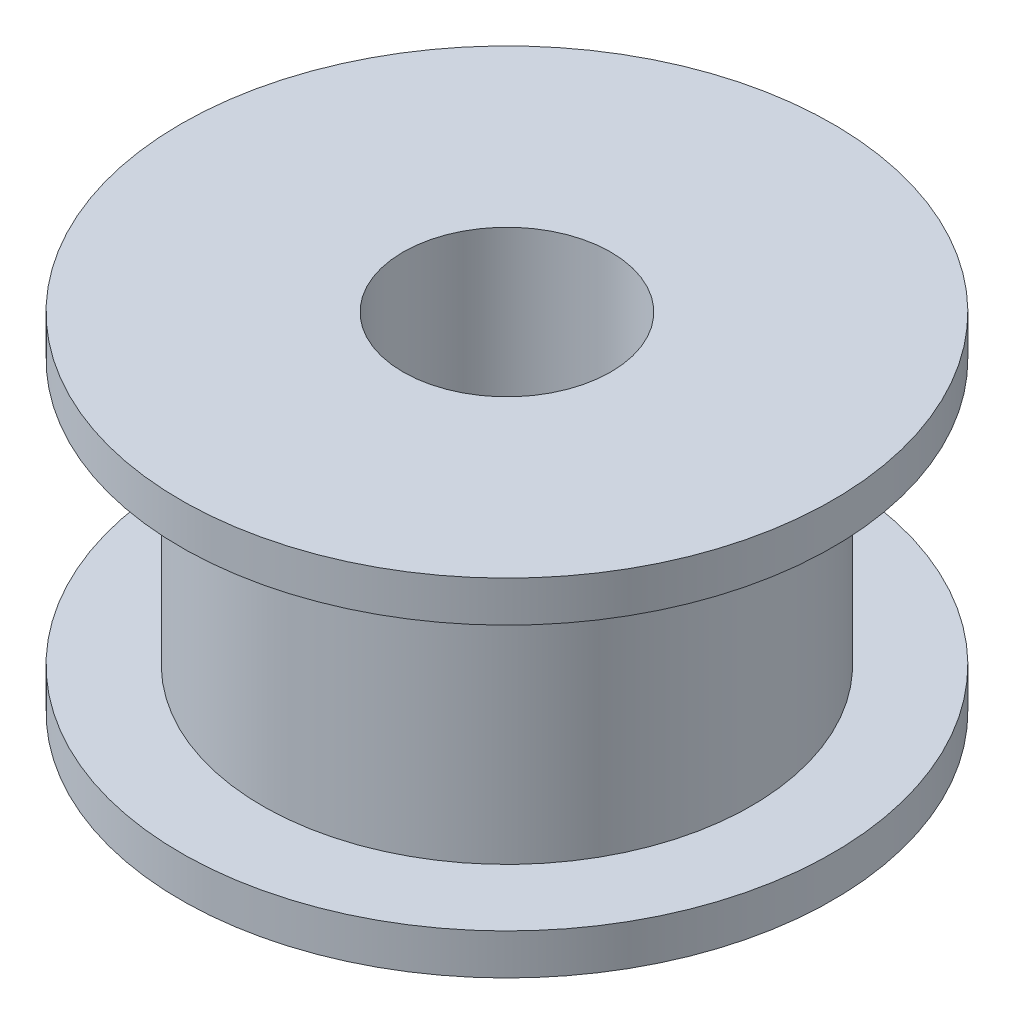
from build123d import *

# Parameters (mm, degrees)
SKETCH2_R          = 2.55
CUT_EXTRUDE1_DEPTH = 15.150971698


with BuildPart() as part:
    # Sketch1 → Revolve1 (revolve)
    with BuildSketch(Plane.XY):
        Polygon((0, 0), (-8, 0), (-8, 1), (-6, 1), (-6, 7.5), (-8, 7.5), (-8, 8.5), (0, 8.5), align=None)
    revolve(axis=Axis((0, 8.5, 0), (0, -1, 0)))

    # Sketch2 → Cut-Extrude1 (cut, through all)
    with BuildSketch(Plane(origin=(0, 8.5, 0), x_dir=(1, 0, 0), z_dir=(0, 1, 0))):
        with Locations(Location((0, 0, 0), (0, 0, 180))):
            Circle(SKETCH2_R)
    extrude(amount=-CUT_EXTRUDE1_DEPTH, mode=Mode.SUBTRACT)


solid = part.part
